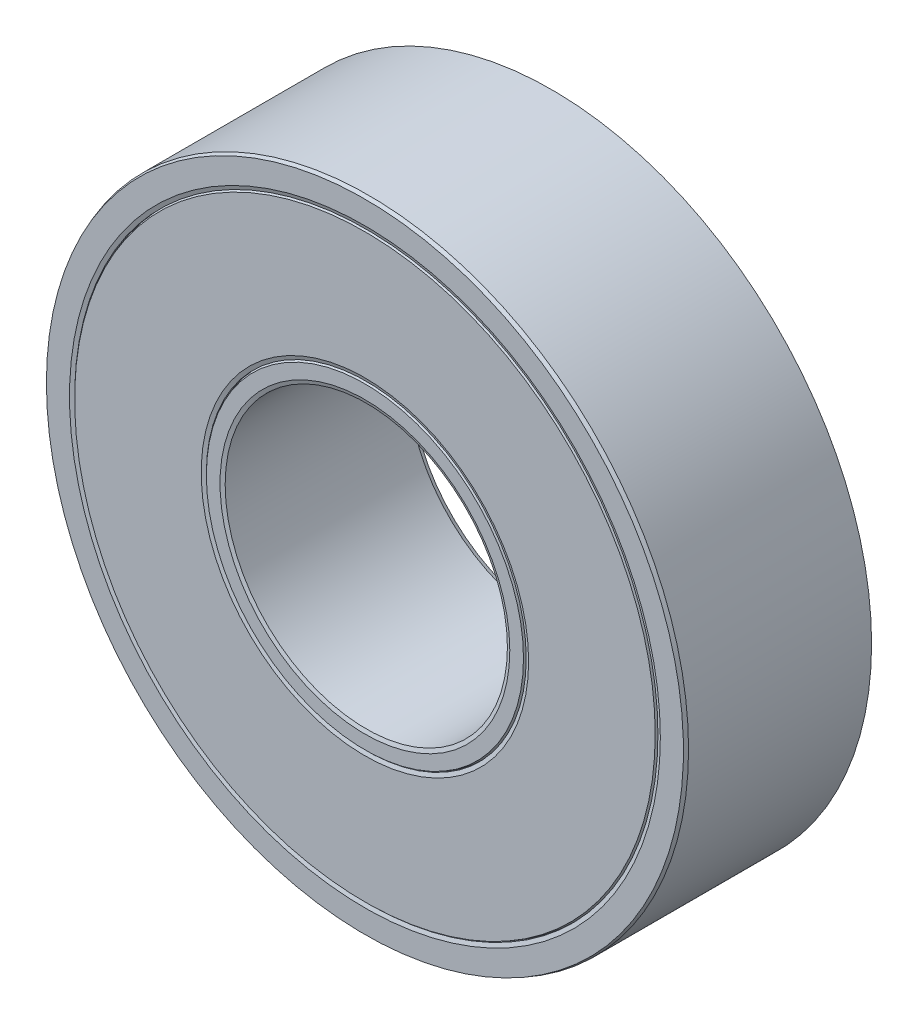
from build123d import *
from OCP.BRepFilletAPI import BRepFilletAPI_MakeChamfer

# Parameters (mm, degrees)
SKETCH1_R           = 8.5
SKETCH1_R_2         = 7.5
BOSS_EXTRUDE1_DEPTH = 10
SKETCH2_R           = 15.5
SKETCH2_R_2         = 8.5
BOSS_EXTRUDE2_DEPTH = 10
SKETCH3_R           = 17
SKETCH3_R_2         = 15.5
BOSS_EXTRUDE3_DEPTH = 10
CHAMFER1_SIZE       = 0.2
CHAMFER1_SIZE2      = 0.072794047
CHAMFER2_SIZE       = 0.2
CHAMFER2_SIZE2      = 0.072794047
CHAMFER3_SIZE       = 0.2
CHAMFER3_SIZE2      = 0.072794047


with BuildPart() as part:
    # Sketch1 → Boss-Extrude1 (new body)
    with BuildSketch(Plane.XY):
        Circle(SKETCH1_R)
        Circle(SKETCH1_R_2, mode=Mode.SUBTRACT)
    extrude(amount=BOSS_EXTRUDE1_DEPTH)

    # Chamfer1: one chamfer whose edges measure the first distance from different faces: ONE call of the kernel's chamfer builder (chamfer() names one face for all edges)
    chamfer1_edges_1 = [part.edges().sort_by_distance(p)[0] for p in [
        (-8.5, 0, 0),
    ]]
    chamfer1_side_1 = [part.faces().sort_by_distance(p)[0] for p in [
        (-8.259583694, 0, 0),
    ]]
    chamfer1_edges_2 = [part.edges().sort_by_distance(p)[0] for p in [
        (-8.5, 0, 10),
    ]]
    chamfer1_side_2 = [part.faces().sort_by_distance(p)[0] for p in [
        (-8.5, 0, 5),
    ]]
    chamfer1_edges_3 = [part.edges().sort_by_distance(p)[0] for p in [
        (-7.5, 0, 0),
    ]]
    chamfer1_side_3 = [part.faces().sort_by_distance(p)[0] for p in [
        (-7.5, 0, 5),
    ]]
    chamfer1_edges_4 = [part.edges().sort_by_distance(p)[0] for p in [
        (-7.5, 0, 10),
    ]]
    chamfer1_side_4 = [part.faces().sort_by_distance(p)[0] for p in [
        (-8.259583694, 0, 10),
    ]]
    chamfer1 = BRepFilletAPI_MakeChamfer(part.part.solid().wrapped)
    for e in chamfer1_edges_1:
        chamfer1.Add(CHAMFER1_SIZE, CHAMFER1_SIZE2, e.wrapped, chamfer1_side_1[0].wrapped)  # the first distance lies on this face
    for e in chamfer1_edges_2:
        chamfer1.Add(CHAMFER1_SIZE, CHAMFER1_SIZE2, e.wrapped, chamfer1_side_2[0].wrapped)  # the first distance lies on this face
    for e in chamfer1_edges_3:
        chamfer1.Add(CHAMFER1_SIZE, CHAMFER1_SIZE2, e.wrapped, chamfer1_side_3[0].wrapped)  # the first distance lies on this face
    for e in chamfer1_edges_4:
        chamfer1.Add(CHAMFER1_SIZE, CHAMFER1_SIZE2, e.wrapped, chamfer1_side_4[0].wrapped)  # the first distance lies on this face
    add(Compound.cast(chamfer1.Shape()), mode=Mode.REPLACE)


with BuildPart() as body_2:
    # Sketch2 → Boss-Extrude2 (new body)
    with BuildSketch(Plane.XY.offset(10)):
        Circle(SKETCH2_R)
        Circle(SKETCH2_R_2, mode=Mode.SUBTRACT)
    extrude(amount=-BOSS_EXTRUDE2_DEPTH)

    # Chamfer2: one chamfer whose edges measure the first distance from different faces: ONE call of the kernel's chamfer builder (chamfer() names one face for all edges)
    chamfer2_edges_1 = [body_2.edges().sort_by_distance(p)[0] for p in [
        (-15.5, 0, 10),
    ]]
    chamfer2_side_1 = [body_2.faces().sort_by_distance(p)[0] for p in [
        (-15.5, 0, 5),
    ]]
    chamfer2_edges_2 = [body_2.edges().sort_by_distance(p)[0] for p in [
        (-15.5, 0, 0),
    ]]
    chamfer2_side_2 = [body_2.faces().sort_by_distance(p)[0] for p in [
        (-15.061593796, 0, 0),
    ]]
    chamfer2_edges_3 = [body_2.edges().sort_by_distance(p)[0] for p in [
        (-8.5, 0, 0),
    ]]
    chamfer2_side_3 = [body_2.faces().sort_by_distance(p)[0] for p in [
        (-8.5, 0, 5),
    ]]
    chamfer2_edges_4 = [body_2.edges().sort_by_distance(p)[0] for p in [
        (-8.5, 0, 10),
    ]]
    chamfer2_side_4 = [body_2.faces().sort_by_distance(p)[0] for p in [
        (-15.061593796, 0, 10),
    ]]
    chamfer2 = BRepFilletAPI_MakeChamfer(body_2.part.solid().wrapped)
    for e in chamfer2_edges_1:
        chamfer2.Add(CHAMFER2_SIZE, CHAMFER2_SIZE2, e.wrapped, chamfer2_side_1[0].wrapped)  # the first distance lies on this face
    for e in chamfer2_edges_2:
        chamfer2.Add(CHAMFER2_SIZE, CHAMFER2_SIZE2, e.wrapped, chamfer2_side_2[0].wrapped)  # the first distance lies on this face
    for e in chamfer2_edges_3:
        chamfer2.Add(CHAMFER2_SIZE, CHAMFER2_SIZE2, e.wrapped, chamfer2_side_3[0].wrapped)  # the first distance lies on this face
    for e in chamfer2_edges_4:
        chamfer2.Add(CHAMFER2_SIZE, CHAMFER2_SIZE2, e.wrapped, chamfer2_side_4[0].wrapped)  # the first distance lies on this face
    add(Compound.cast(chamfer2.Shape()), mode=Mode.REPLACE)


with BuildPart() as body_3:
    # Sketch3 → Boss-Extrude3 (new body)
    with BuildSketch(Plane.XY.offset(10)):
        Circle(SKETCH3_R)
        Circle(SKETCH3_R_2, mode=Mode.SUBTRACT)
    extrude(amount=-BOSS_EXTRUDE3_DEPTH)

    # Chamfer3: one chamfer whose edges measure the first distance from different faces: ONE call of the kernel's chamfer builder (chamfer() names one face for all edges)
    chamfer3_edges_1 = [body_3.edges().sort_by_distance(p)[0] for p in [
        (-17, 0, 10),
    ]]
    chamfer3_side_1 = [body_3.faces().sort_by_distance(p)[0] for p in [
        (-17, 0, 5),
    ]]
    chamfer3_edges_2 = [body_3.edges().sort_by_distance(p)[0] for p in [
        (-17, 0, 0),
    ]]
    chamfer3_side_2 = [body_3.faces().sort_by_distance(p)[0] for p in [
        (-16.519167389, 0, 0),
    ]]
    chamfer3_edges_3 = [body_3.edges().sort_by_distance(p)[0] for p in [
        (-15.5, 0, 0),
    ]]
    chamfer3_side_3 = [body_3.faces().sort_by_distance(p)[0] for p in [
        (-15.5, 0, 5),
    ]]
    chamfer3_edges_4 = [body_3.edges().sort_by_distance(p)[0] for p in [
        (-15.5, 0, 10),
    ]]
    chamfer3_side_4 = [body_3.faces().sort_by_distance(p)[0] for p in [
        (-16.519167389, 0, 10),
    ]]
    chamfer3 = BRepFilletAPI_MakeChamfer(body_3.part.solid().wrapped)
    for e in chamfer3_edges_1:
        chamfer3.Add(CHAMFER3_SIZE, CHAMFER3_SIZE2, e.wrapped, chamfer3_side_1[0].wrapped)  # the first distance lies on this face
    for e in chamfer3_edges_2:
        chamfer3.Add(CHAMFER3_SIZE, CHAMFER3_SIZE2, e.wrapped, chamfer3_side_2[0].wrapped)  # the first distance lies on this face
    for e in chamfer3_edges_3:
        chamfer3.Add(CHAMFER3_SIZE, CHAMFER3_SIZE2, e.wrapped, chamfer3_side_3[0].wrapped)  # the first distance lies on this face
    for e in chamfer3_edges_4:
        chamfer3.Add(CHAMFER3_SIZE, CHAMFER3_SIZE2, e.wrapped, chamfer3_side_4[0].wrapped)  # the first distance lies on this face
    add(Compound.cast(chamfer3.Shape()), mode=Mode.REPLACE)


solid = Compound([part.part, body_2.part, body_3.part])
